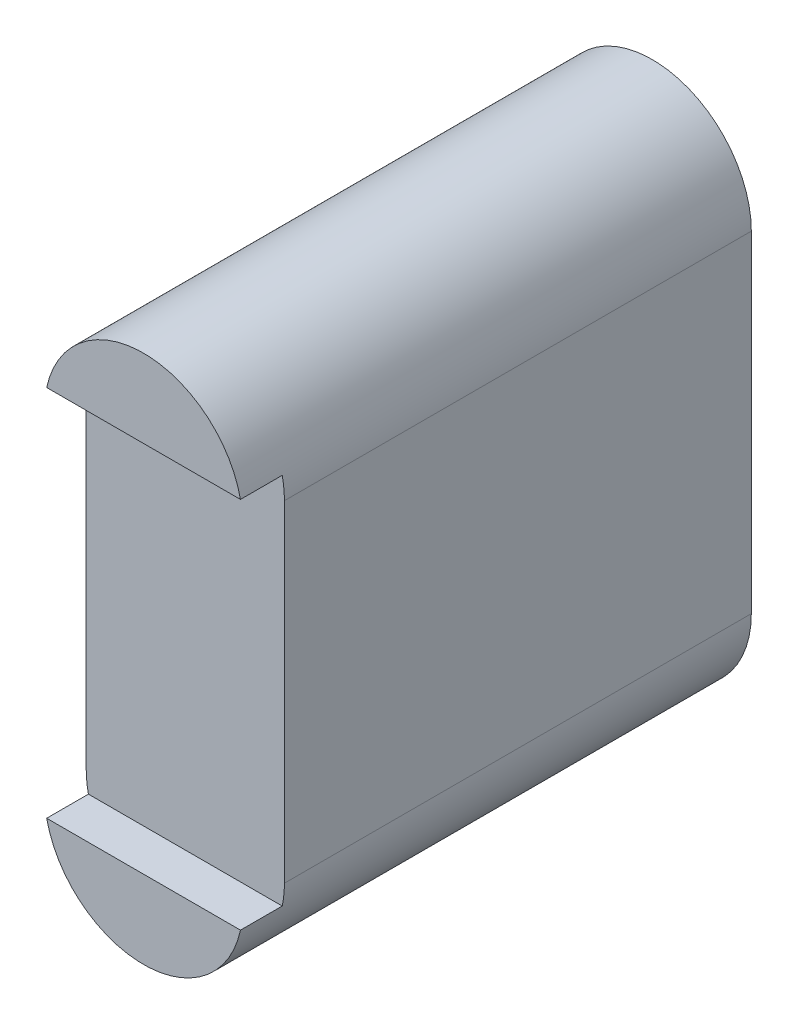
from build123d import *

# Parameters (mm, degrees)
EXTRUDE_1_DEPTH     = 195
SKETCH_2_W          = 76
SKETCH_2_H          = 143
CUT_EXTRUDE_1_DEPTH = 16


with BuildPart() as part:
    # Эскиз1 → Бобышка-Вытянуть1 (new body)
    with BuildSketch(Plane.XY):
        with BuildLine():
            Line((-38, -63.5), (-38, 63.5))
            ThreePointArc((-38, 63.5), (0, 101.5), (38, 63.5))
            Line((38, 63.5), (38, -63.5))
            ThreePointArc((38, -63.5), (0, -101.5), (-38, -63.5))
        make_face()
    extrude(amount=EXTRUDE_1_DEPTH)

    # Эскиз2 → Вырез-Вытянуть1 (cut)
    with BuildSketch(Plane.XY.offset(195)):
        Rectangle(SKETCH_2_W, SKETCH_2_H)
    extrude(amount=-CUT_EXTRUDE_1_DEPTH, mode=Mode.SUBTRACT)


solid = part.part
